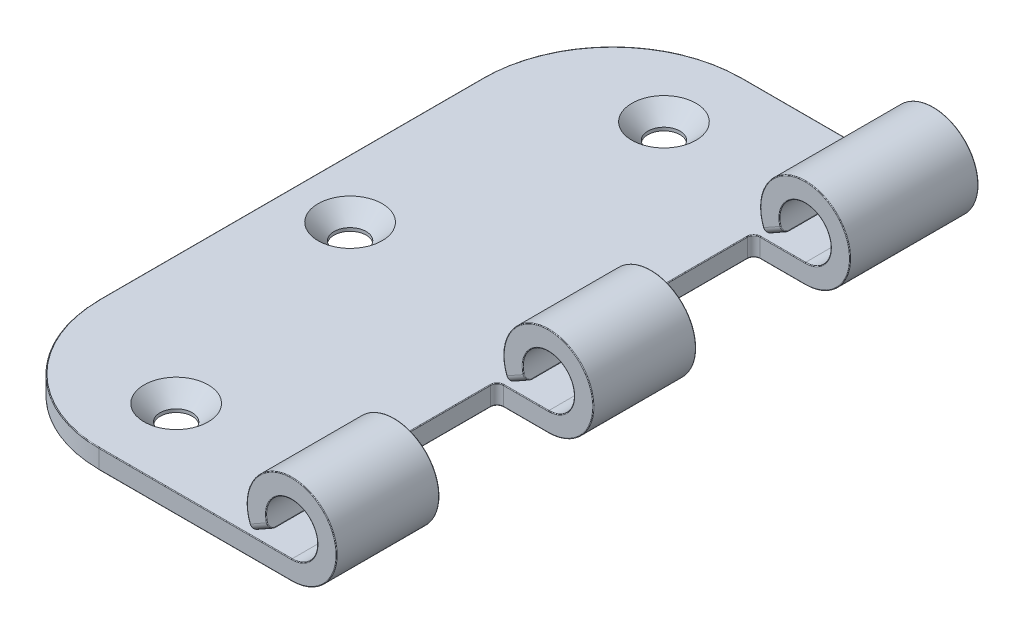
from build123d import *

# Parameters (mm, degrees)
BOSS_EXTRUDE1_DEPTH     = 100
CUT_EXTRUDE1_DEPTH      = 84
CUT_EXTRUDE1_DEPTH_BACK = 73
SKETCH2_W               = 17.512688504
SKETCH2_H               = 24
SKETCH2_W_2             = 21.43524199
FILLET1_R               = 1
FILLET2_R               = 20
SKETCH4_R               = 2.5
CUT_EXTRUDE2_DEPTH      = 4
CHAMFER1_SIZE           = 2.5
FILLET3_R               = 1
FILLET4_R               = 0.1


with BuildPart() as part:
    # Sketch1 → Boss-Extrude1 (new body)
    with BuildSketch(Plane.XY):
        with BuildLine():
            Line((0, -7), (-50, -7))
            Line((-50, -7), (-50, -4))
            Line((-50, -4), (0, -4))
            ThreePointArc((0, -4), (2.013924217, 3.456025065), (-3.480086286, -1.972054624))
            Line((-3.480086286, -1.972054624), (-6.090151001, -3.451095592))
            ThreePointArc((-6.090151001, -3.451095592), (3.52436738, 6.048043863), (0, -7))
        make_face()
    extrude(amount=BOSS_EXTRUDE1_DEPTH)

    # Sketch2 → Cut-Extrude1 (cut, two sides: drawn at the far end of the back side and taken through both)
    with BuildSketch(Plane(origin=(0, -4, 0), x_dir=(1, 0, 0), z_dir=(0, 1, 0)).offset(-CUT_EXTRUDE1_DEPTH_BACK)):
        with Locations((0.756344252, -32)):
            Rectangle(SKETCH2_W, SKETCH2_H)
        with Locations((2.717620995, -72)):
            Rectangle(SKETCH2_W_2, SKETCH2_H)
    extrude(amount=CUT_EXTRUDE1_DEPTH + CUT_EXTRUDE1_DEPTH_BACK, mode=Mode.SUBTRACT)

    # Fillet1
    fillet1_edges = [part.edges().sort_by_distance(p)[0] for p in [
        (-8, -5.5, 20),
        (-8, -5.5, 44),
        (-8, -5.5, 60),
        (-8, -5.5, 84),
    ]]
    fillet(fillet1_edges, radius=FILLET1_R)

    # Fillet2
    fillet2_edges = [part.edges().sort_by_distance(p)[0] for p in [
        (-50, -5.5, 100),
        (-50, -5.5, 0),
    ]]
    fillet(fillet2_edges, radius=FILLET2_R)

    # Sketch4 → Cut-Extrude2 (cut)
    with BuildSketch(Plane(origin=(0, -4, 0), x_dir=(1, 0, 0), z_dir=(0, 1, 0))):
        with Locations(Location((-30, -12, 0), (0, 0, 270))):
            Circle(SKETCH4_R)
        with Locations(Location((-40.898351451, -50, 0), (0, 0, 270))):
            Circle(SKETCH4_R)
        with Locations(Location((-30, -88, 0), (0, 0, 180))):
            Circle(SKETCH4_R)
    extrude(amount=-CUT_EXTRUDE2_DEPTH, mode=Mode.SUBTRACT)

    # Chamfer1
    chamfer1_edges = [part.edges().sort_by_distance(p)[0] for p in [
        (-30, -4, 9.5),
        (-40.898351451, -4, 47.5),
        (-27.5, -4, 88),
    ]]
    chamfer(chamfer1_edges, length=CHAMFER1_SIZE)

    # Fillet3
    fillet3_edges = [part.edges().sort_by_distance(p)[0] for p in [
        (-4.785118643, -2.711575108, 84),
        (-4.785118643, -2.711575108, 60),
        (-4.785118643, -2.711575108, 44),
        (-4.785118643, -2.711575108, 20),
        (-4.785118643, -2.711575108, 100),
        (-4.785118643, -2.711575108, 0),
    ]]
    fillet(fillet3_edges, radius=FILLET3_R)

    # Fillet4
    fillet4_edges = [part.edges().sort_by_distance(p)[0] for p in [
        (-15, -7, 100),
        (-50, -7, 50),
        (-15, -7, 0),
        (-44.142135624, -7, 5.857864376),
        (-44.142135624, -7, 94.142135624),
        (-50, -4, 50),
        (-44.142135624, -4, 5.857864376),
        (-44.142135624, -4, 94.142135624),
        (-6.090151001, -3.451095592, 10),
        (-3.480086286, -1.972054624, 10),
        (2.433346622, 3.174716399, 20),
        (2.433346622, 3.174716399, 0),
        (-3.616635295, -1.708785869, 19.710566573),
        (-3.616635295, -1.708785869, 0.289433427),
        (-6.229724968, -3.192260456, 19.708215844),
        (-6.229724968, -3.192260456, 0.291784156),
        (3.948433827, 5.780127188, 44),
        (-6.090151001, -3.451095592, 52),
        (-6.229724968, -3.192260456, 59.708215844),
        (-6.229724968, -3.192260456, 44.291784156),
        (-3.480086286, -1.972054624, 52),
        (2.433346622, 3.174716399, 60),
        (-3.616635295, -1.708785869, 59.710566573),
        (-3.616635295, -1.708785869, 44.289433427),
        (3.948433827, 5.780127188, 84),
        (-6.090151001, -3.451095592, 92),
        (-6.229724968, -3.192260456, 99.708215844),
        (-6.229724968, -3.192260456, 84.291784156),
        (-3.480086286, -1.972054624, 92),
        (2.433346622, 3.174716399, 100),
        (-3.616635295, -1.708785869, 99.710566573),
        (-3.616635295, -1.708785869, 84.289433427),
        (3.948433827, 5.780127188, 100),
        (-3.5, -4, 20),
        (3.948433827, 5.780127188, 20),
        (2.433346622, 3.174716399, 44),
        (-3.5, -7, 44),
        (-3.5, -4, 60),
        (3.948433827, 5.780127188, 60),
        (2.433346622, 3.174716399, 84),
        (-3.5, -7, 84),
        (-8, -4, 72),
        (-8, -7, 72),
        (3.948433827, 5.780127188, 0),
        (-3.5, -4, 84),
        (-3.5, -7, 60),
        (-8, -4, 32),
        (-8, -7, 32),
        (-3.5, -4, 44),
        (-3.5, -7, 20),
        (-7.707106781, -7, 83.707106781),
        (-7.707106781, -4, 83.707106781),
        (-7.707106781, -7, 60.292893219),
        (-7.707106781, -4, 60.292893219),
        (-7.707106781, -7, 43.707106781),
        (-7.707106781, -4, 43.707106781),
        (-7.707106781, -7, 20.292893219),
        (-7.707106781, -4, 20.292893219),
        (-15, -4, 0),
        (-15, -4, 100),
    ]]
    fillet(fillet4_edges, radius=FILLET4_R)


solid = part.part
